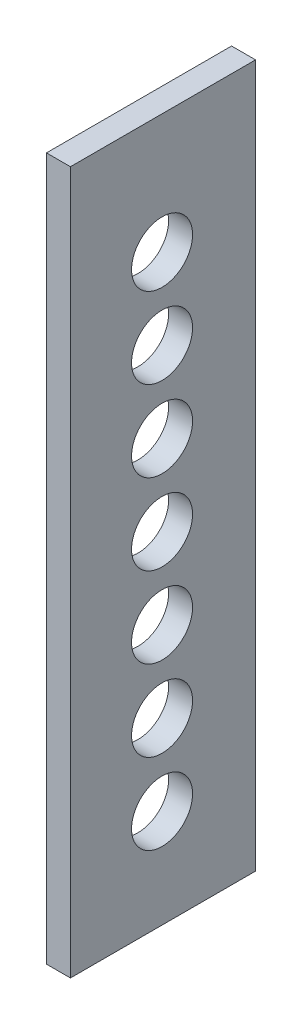
from build123d import *

# Parameters (mm, degrees)
SKETCH_1_W      = 42.461745147
SKETCH_1_H      = 161.164904789
SKETCH_1_R      = 7
EXTRUDE_1_DEPTH = 5.5


with BuildPart() as part:
    # Эскиз1 → Вытянуть1 (new body)
    with BuildSketch(Plane(origin=(0, 0, 0), x_dir=(0, 0, -1), z_dir=(1, 0, 0))):
        with Locations((21.230872574, -80.582452395)):
            Rectangle(SKETCH_1_W, SKETCH_1_H)
        with Locations((21.015980905, -27.468155655)):
            Circle(SKETCH_1_R, mode=Mode.SUBTRACT)
        with Locations((21.015980905, -45.981315628)):
            Circle(SKETCH_1_R, mode=Mode.SUBTRACT)
        with Locations((21.015980905, -64.4944756)):
            Circle(SKETCH_1_R, mode=Mode.SUBTRACT)
        with Locations((21.015980905, -83.007635573)):
            Circle(SKETCH_1_R, mode=Mode.SUBTRACT)
        with Locations((21.015980905, -101.520795545)):
            Circle(SKETCH_1_R, mode=Mode.SUBTRACT)
        with Locations((21.015980905, -120.033955517)):
            Circle(SKETCH_1_R, mode=Mode.SUBTRACT)
        with Locations((21.015980905, -138.54711549)):
            Circle(SKETCH_1_R, mode=Mode.SUBTRACT)
    extrude(amount=EXTRUDE_1_DEPTH)


solid = part.part
